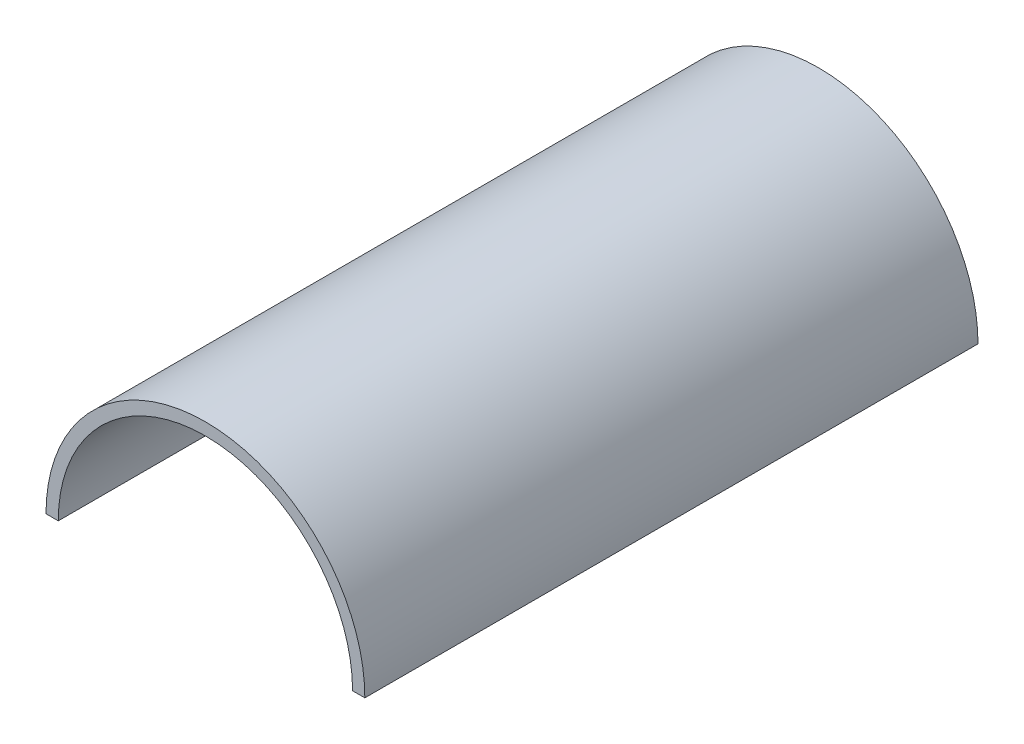
from build123d import *

# Parameters (mm, degrees)
BOSS_EXTRU_1_DEPTH = 100


with BuildPart() as part:
    # Esquisse1 → Boss.-Extru.1 (new body)
    with BuildSketch(Plane.XY):
        with BuildLine():
            Line((-26, 0), (-24, 0))
            ThreePointArc((-24, 0), (0, 24), (24, 0))
            Line((24, 0), (26, 0))
            ThreePointArc((26, 0), (18.384776311, 18.384776311), (0, 26))
            ThreePointArc((0, 26), (-18.384776311, 18.384776311), (-26, 0))
        make_face()
    extrude(amount=BOSS_EXTRU_1_DEPTH)


solid = part.part
